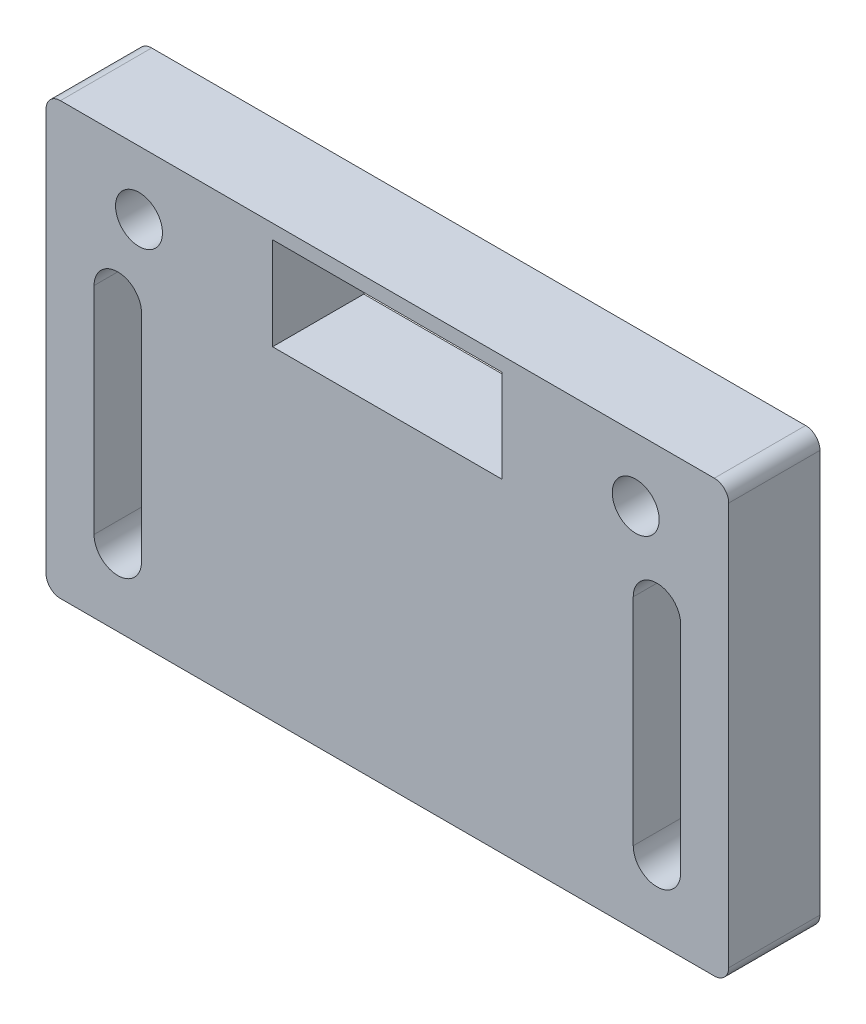
from build123d import *

# Parameters (mm, degrees)
SKETCH1_W                                        = 95
SKETCH1_H                                        = 60
BOSS_EXTRUDE1_DEPTH                              = 12.7
CSK_FOR_1_4_FLAT_HEAD_MACHINE_SCREW2_D           = 6.5278
CSK_FOR_1_4_FLAT_HEAD_MACHINE_SCREW2_CSINK_D     = 12.8778
CSK_FOR_1_4_FLAT_HEAD_MACHINE_SCREW2_CSINK_ANGLE = 82
FILLET1_R                                        = 2
FILLET2_R                                        = 2
CUT_EXTRUDE1_DEPTH                               = 78.572804513


with BuildPart() as part:
    # Sketch1 → Boss-Extrude1 (new body)
    with BuildSketch(Plane.XY):
        with Locations((0, -30)):
            Rectangle(SKETCH1_W, SKETCH1_H)
        Polygon((0, -2), (15.975, -2), (15.975, -14.9), (-15.975, -14.9), (-15.975, -2), align=None, mode=Mode.SUBTRACT)
    extrude(amount=BOSS_EXTRUDE1_DEPTH)

    # CSK for 1/4 Flat Head Machine Screw2 (through all)
    with Locations(Plane(origin=(0, 0, 0), x_dir=(-1, 0, 0), z_dir=(0, 0, -1))):
        with Locations((-34.56, -8.845086615), (34.56, -8.845086615)):
            CounterSinkHole(CSK_FOR_1_4_FLAT_HEAD_MACHINE_SCREW2_D / 2, CSK_FOR_1_4_FLAT_HEAD_MACHINE_SCREW2_CSINK_D / 2, counter_sink_angle=CSK_FOR_1_4_FLAT_HEAD_MACHINE_SCREW2_CSINK_ANGLE)

    # Fillet1
    fillet1_edges = [part.edges().sort_by_distance(p)[0] for p in [
        (-47.5, 0, 6.35),
        (-47.5, -60, 6.35),
    ]]
    fillet(fillet1_edges, radius=FILLET1_R)

    # Fillet2
    fillet2_edges = [part.edges().sort_by_distance(p)[0] for p in [
        (47.5, 0, 6.35),
        (47.5, -60, 6.35),
    ]]
    fillet(fillet2_edges, radius=FILLET2_R)

    # Sketch9 → Cut-Extrude1 (cut, through all)
    with BuildSketch(Plane(origin=(0, 0, 0), x_dir=(-1, 0, 0), z_dir=(0, 0, -1))):
        with BuildLine():
            Line((-34.215, -49.94085979), (-34.215, -19.94085979))
            ThreePointArc((-34.215, -19.94085979), (-37.515, -16.64085979), (-40.815, -19.94085979))
            Line((-40.815, -19.94085979), (-40.815, -49.94085979))
            ThreePointArc((-40.815, -49.94085979), (-37.515, -53.24085979), (-34.215, -49.94085979))
        make_face()
        with BuildLine():
            Line((40.815, -49.94085979), (40.815, -19.94085979))
            ThreePointArc((40.815, -19.94085979), (37.515, -16.64085979), (34.215, -19.94085979))
            Line((34.215, -19.94085979), (34.215, -49.94085979))
            ThreePointArc((34.215, -49.94085979), (37.515, -53.24085979), (40.815, -49.94085979))
        make_face()
    extrude(amount=-CUT_EXTRUDE1_DEPTH, mode=Mode.SUBTRACT)


solid = part.part
